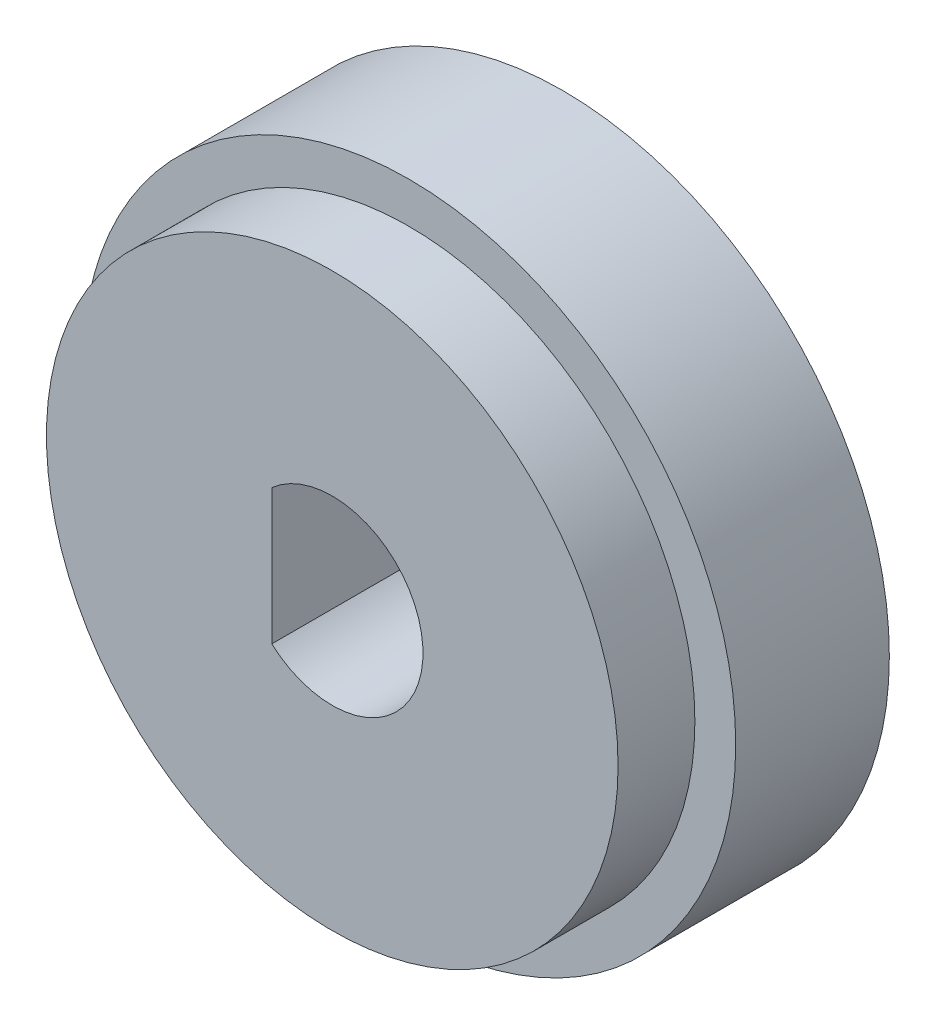
from build123d import *

# Parameters (mm, degrees)
SKETCH1_R           = 10.8
BOSS_EXTRUDE1_DEPTH = 5.08
SKETCH2_R           = 9.45
BOSS_EXTRUDE2_DEPTH = 2.54
CUT_EXTRUDE1_DEPTH  = 18.068813667


with BuildPart() as part:
    # Sketch1 → Boss-Extrude1 (new body)
    with BuildSketch(Plane.XY):
        Circle(SKETCH1_R)
    extrude(amount=BOSS_EXTRUDE1_DEPTH)

    # Sketch2 → Boss-Extrude2 (add)
    with BuildSketch(Plane.XY.offset(5.08)):
        Circle(SKETCH2_R)
    extrude(amount=BOSS_EXTRUDE2_DEPTH)

    # Sketch3 → Cut-Extrude1 (cut, through all)
    with BuildSketch(Plane.XY.offset(7.62)):
        with BuildLine():
            Line((-2, 0), (-2, 2.236067977))
            ThreePointArc((-2, 2.236067977), (3, 0), (-2, -2.236067977))
            Line((-2, -2.236067977), (-2, 0))
        make_face()
    extrude(amount=-CUT_EXTRUDE1_DEPTH, mode=Mode.SUBTRACT)


solid = part.part
